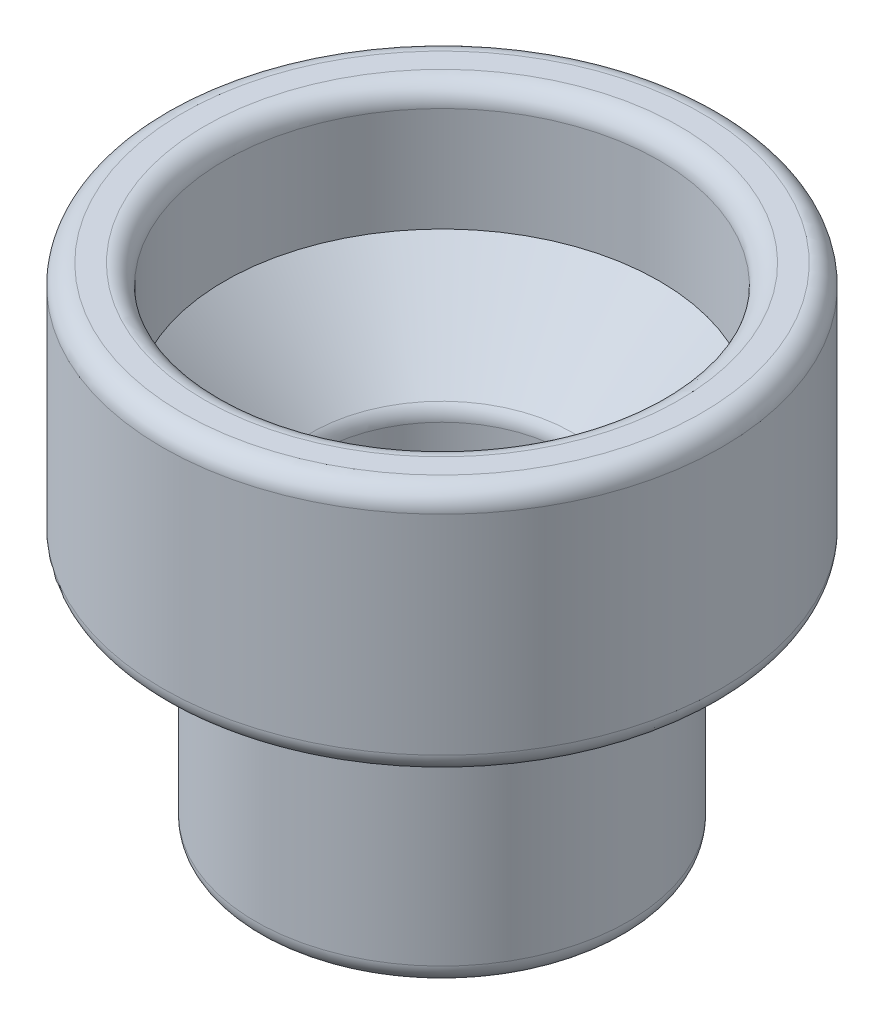
from build123d import *

# Parameters (mm, degrees)
RADYUS1_R = 1.016


with BuildPart() as part:
    # Sketch1 → Döndür1 (revolve)
    with BuildSketch(Plane.XY, mode=Mode.PRIVATE) as d_nd_r1_sk:
        Polygon((6.35, -12.7), (9.525, -12.7), (9.525, 0), (14.2875, 0), (14.2875, 12.7), (11.1125, 12.7), (11.1125, 6.35), (6.35, 1.5875), align=None)
    revolve(d_nd_r1_sk.sketch.rotate(Axis((0, 0, 0), (0, 1, 0)), 90), axis=Axis((0, 0, 0), (0, 1, 0)))

    # Radyus1
    radyus1_edges = [part.edges().sort_by_distance(p)[0] for p in [
        (0, 1.5875, 6.35),
        (0, 12.7, 11.1125),
        (0, 12.7, 14.2875),
        (0, 0, 14.2875),
        (0, -12.7, 9.525),
    ]]
    fillet(radyus1_edges, radius=RADYUS1_R)


solid = part.part
